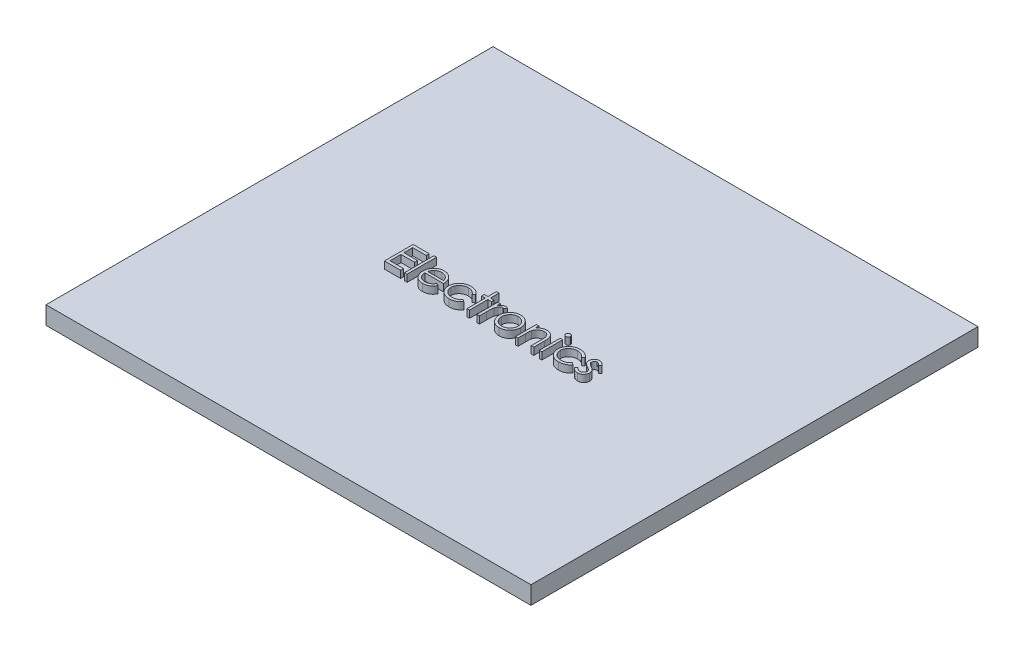
from build123d import *

# Parameters (mm, degrees)
SKETCH1_W           = 86.106
SKETCH1_H           = 79.375
BOSS_EXTRUDE1_DEPTH = 3.175
SKETCH2_W           = 0.455897436
SKETCH2_H           = 5.21025641
SKETCH2_H_2         = 3.712307692
BOSS_EXTRUDE2_DEPTH = 1.27


with BuildPart() as part:
    # Sketch1 → Boss-Extrude1 (new body)
    with BuildSketch(Plane(origin=(0, 0, 0), x_dir=(1, 0, 0), z_dir=(0, 1, 0))):
        with Locations((43.053, 39.6875)):
            Rectangle(SKETCH1_W, SKETCH1_H)
    extrude(amount=BOSS_EXTRUDE1_DEPTH)

    # Sketch2 → Boss-Extrude2 (add)
    # profile 1 of 12: a face of its own
    with BuildSketch(Plane(origin=(0, 3.175, 0), x_dir=(1, 0, 0), z_dir=(0, 1, 0))):
        Polygon((24.586053193, 40.592933787), (27.451694219, 40.592933787), (27.451694219, 40.071908146), (25.041950629, 40.071908146), (25.041950629, 38.508831223), (27.451694219, 38.508831223), (27.451694219, 37.987805582), (25.041950629, 37.987805582), (25.041950629, 36.033959428), (27.451694219, 36.033959428), (27.451694219, 35.512933787), (24.586053193, 35.512933787), align=None)
    # profile 2 of 12: a face of its own
    with BuildSketch(Plane(origin=(0, 3.175, 0), x_dir=(1, 0, 0), z_dir=(0, 1, 0))):
        with Locations((28.396053193, 38.118061992)):
            Rectangle(SKETCH2_W, SKETCH2_H)
    # profile 3 of 12: a face of its own
    with BuildSketch(Plane(origin=(0, 3.175, 0), x_dir=(1, 0, 0), z_dir=(0, 1, 0))):
        with BuildLine():
            Line((32.712832039, 36.685241479), (33.117848065, 36.472557184))
            add(Edge.make_bspline(
                [(33.117848065, 36.472557184), (33.085573235, 36.415308006), (33.022779198, 36.303923777), (32.914791827, 36.150896962), (32.801591904, 36.013232278), (32.678069574, 35.894607522), (32.54792044, 35.791191226), (32.410422758, 35.700712326), (32.264860702, 35.623614588), (32.111227387, 35.558659491), (31.94823261, 35.508716568), (31.775481381, 35.473440727), (31.592642753, 35.451635526), (31.467317441, 35.449102579), (31.403144539, 35.447805582)],
                knots=[0, 0, 0, 0, 1.120438281, 2.179929193, 3.190490725, 4.156257408, 5.095198341, 6.022838206, 6.959905092, 7.901321166, 8.864066838, 9.862729781, 10.905609505, 12, 12, 12, 12], degree=3))
            add(Edge.make_bspline(
                [(31.403144539, 35.447805582), (31.331818469, 35.449470625), (31.192681969, 35.452718641), (30.990149994, 35.480720275), (30.799462152, 35.526400156), (30.620629165, 35.590212999), (30.454088982, 35.673564658), (30.299510598, 35.775105849), (30.156081115, 35.89431495), (30.028320263, 36.032224531), (29.913303427, 36.179808629), (29.811811094, 36.333596027), (29.726964309, 36.493199792), (29.657945092, 36.657603867), (29.602203173, 36.825772033), (29.563353215, 36.999234392), (29.540958038, 37.177521468), (29.537526214, 37.298131315), (29.535796783, 37.358911351)],
                knots=[0, 0, 0, 0, 1.145258523, 2.234067595, 3.276747158, 4.290159414, 5.277019952, 6.260822364, 7.254936242, 8.264827045, 9.274100331, 10.257902744, 11.220704747, 12.172965371, 13.118907548, 14.062713208, 15.023725156, 16, 16, 16, 16], degree=3))
            add(Edge.make_bspline(
                [(29.535796783, 37.358911351), (29.537334051, 37.41594499), (29.540380713, 37.528978132), (29.559584256, 37.696277837), (29.593617778, 37.858879134), (29.640319414, 38.016917132), (29.70062808, 38.170127224), (29.774407416, 38.318602654), (29.861772353, 38.462185428), (29.929224119, 38.552759119), (29.963200629, 38.598382505)],
                knots=[0, 0, 0, 0, 1.024358464, 2.0301432, 3.019427413, 4.004406732, 4.986367066, 5.972626655, 6.978780325, 8, 8, 8, 8], degree=3))
            add(Edge.make_bspline(
                [(29.963200629, 38.598382505), (30.009222066, 38.653346465), (30.099807097, 38.761533266), (30.253014607, 38.90368375), (30.418913178, 39.02276443), (30.595423766, 39.12147193), (30.784597849, 39.196472538), (30.983892477, 39.252363543), (31.195576928, 39.283682484), (31.340291934, 39.288106197), (31.41433845, 39.290369684)],
                knots=[0, 0, 0, 0, 1.030682036, 2.02871468, 2.997146059, 3.962720338, 4.930598197, 5.918074684, 6.934738563, 8, 8, 8, 8], degree=3))
            add(Edge.make_bspline(
                [(31.41433845, 39.290369684), (31.490462403, 39.288404379), (31.639800245, 39.284548898), (31.857561152, 39.248805534), (32.063606992, 39.192123541), (32.257855313, 39.112071753), (32.440325808, 39.008788747), (32.609832417, 38.88085716), (32.769274041, 38.732204621), (32.862032778, 38.617885449), (32.909234283, 38.559712633)],
                knots=[0, 0, 0, 0, 1.056321875, 2.072262726, 3.055038591, 4.01806755, 4.982017516, 5.957941055, 6.960871419, 8, 8, 8, 8], degree=3))
            add(Edge.make_bspline(
                [(32.909234283, 38.559712633), (32.941349953, 38.515874292), (33.005367523, 38.428489411), (33.085554742, 38.286000989), (33.155161476, 38.136923897), (33.21079903, 37.978848381), (33.255850649, 37.81364739), (33.288445118, 37.640139925), (33.307559878, 37.458377654), (33.311317188, 37.334532253), (33.31323268, 37.271395325)],
                knots=[0, 0, 0, 0, 0.94817472, 1.890038105, 2.849395472, 3.817997239, 4.812318967, 5.836947057, 6.897266129, 8, 8, 8, 8], degree=3))
            Line((33.31323268, 37.271395325), (29.991694219, 37.271395325))
            add(Edge.make_bspline(
                [(29.991694219, 37.271395325), (29.993928848, 37.222481508), (29.998323155, 37.126294461), (30.018810277, 36.985548296), (30.051102783, 36.851474987), (30.096487594, 36.725080172), (30.151448615, 36.604713016), (30.21877417, 36.491266402), (30.299095579, 36.385257064), (30.388686023, 36.285736761), (30.488409464, 36.197111428), (30.593322709, 36.117788278), (30.704928226, 36.051304726), (30.822346016, 35.997340772), (30.945386207, 35.955095033), (31.074087564, 35.926258311), (31.20819683, 35.906943996), (31.299616124, 35.904796367), (31.34615736, 35.903703017)],
                knots=[0, 0, 0, 0, 1.094153842, 2.151609401, 3.174256925, 4.172055639, 5.149267565, 6.128595816, 7.11444997, 8.118368179, 9.117203808, 10.09244225, 11.054858984, 12.015122123, 12.976791628, 13.957293641, 14.960065497, 16, 16, 16, 16], degree=3))
            add(Edge.make_bspline(
                [(31.34615736, 35.903703017), (31.391661311, 35.904585568), (31.48194988, 35.906336718), (31.616411467, 35.923364749), (31.748693981, 35.950898749), (31.878249923, 35.98847622), (32.002449893, 36.034307766), (32.117469149, 36.089611342), (32.223249576, 36.150788689), (32.322116487, 36.220761588), (32.418013815, 36.306407757), (32.513144052, 36.413284746), (32.615145595, 36.539686072), (32.678993347, 36.634820925), (32.712832039, 36.685241479)],
                knots=[0, 0, 0, 0, 0.99110716, 1.966546729, 2.947904876, 3.932708344, 4.903319531, 5.828989031, 6.710028674, 7.56322171, 8.463672341, 9.504779593, 10.677557249, 12, 12, 12, 12], degree=3))
        make_face()
        with BuildLine():
            add(Edge.make_bspline(
                [(32.857335245, 37.727292761), (32.840648715, 37.787763446), (32.808532518, 37.90415005), (32.741423737, 38.065317971), (32.665845615, 38.20855641), (32.576406074, 38.332769135), (32.475069181, 38.443082805), (32.358018458, 38.539484637), (32.226757219, 38.625724823), (32.081963952, 38.698517594), (31.928632446, 38.760478874), (31.768095459, 38.802026185), (31.604290441, 38.830488035), (31.493496677, 38.833138501), (31.437743898, 38.834472248)],
                knots=[0, 0, 0, 0, 1.154881502, 2.222775134, 3.210006277, 4.132804581, 5.035138423, 5.962687519, 6.919655026, 7.923214229, 8.944639381, 9.960483929, 10.97369054, 12, 12, 12, 12], degree=3))
            add(Edge.make_bspline(
                [(31.437743898, 38.834472248), (31.392242428, 38.833584451), (31.302295586, 38.831829462), (31.169778607, 38.815181388), (31.042517787, 38.787662528), (30.919574112, 38.749976248), (30.802558681, 38.699744333), (30.68906456, 38.640840679), (30.581977585, 38.568934608), (30.51500679, 38.514130328), (30.481173386, 38.486443402)],
                knots=[0, 0, 0, 0, 1.04873581, 2.073130211, 3.073294108, 4.04793562, 5.032784715, 6.005352987, 6.992311501, 8, 8, 8, 8], degree=3))
            add(Edge.make_bspline(
                [(30.481173386, 38.486443402), (30.456944279, 38.464535081), (30.407910473, 38.420197979), (30.34239223, 38.343810445), (30.279660801, 38.261439606), (30.222570814, 38.169934111), (30.170206774, 38.070335952), (30.121206579, 37.963485213), (30.077102872, 37.848571069), (30.052289089, 37.768492215), (30.039522745, 37.727292761)],
                knots=[0, 0, 0, 0, 0.879870761, 1.780643979, 2.707998968, 3.669668524, 4.684282772, 5.740141944, 6.837334558, 8, 8, 8, 8], degree=3))
            Line((30.039522745, 37.727292761), (32.857335245, 37.727292761))
        make_face(mode=Mode.SUBTRACT)
    # profile 4 of 12: a face of its own
    with BuildSketch(Plane(origin=(0, 3.175, 0), x_dir=(1, 0, 0), z_dir=(0, 1, 0))):
        with BuildLine():
            Line((37.872207039, 38.420297569), (37.490596462, 38.183190197))
            add(Edge.make_bspline(
                [(37.490596462, 38.183190197), (37.448751972, 38.235192551), (37.366388197, 38.337550357), (37.223365534, 38.469644775), (37.070948967, 38.583098652), (36.906533972, 38.675560097), (36.730351154, 38.747001516), (36.543095313, 38.797555071), (36.344793151, 38.82905723), (36.208844805, 38.832637667), (36.139186206, 38.834472248)],
                knots=[0, 0, 0, 0, 1.026593902, 2.0206758, 2.988051866, 3.946915611, 4.916868779, 5.907761954, 6.927957743, 8, 8, 8, 8], degree=3))
            add(Edge.make_bspline(
                [(36.139186206, 38.834472248), (36.08351092, 38.832938317), (35.973859958, 38.829917282), (35.812887598, 38.81103348), (35.659555269, 38.776718794), (35.512901897, 38.731505405), (35.373970546, 38.670907841), (35.242397213, 38.59716111), (35.117014845, 38.511454194), (35.001456832, 38.412161174), (34.89575073, 38.304176822), (34.804167163, 38.18842003), (34.724430129, 38.068358016), (34.661864912, 37.940992631), (34.610665522, 37.809237673), (34.576982625, 37.670606134), (34.554536725, 37.526874055), (34.55196867, 37.428876007), (34.550668578, 37.379263915)],
                knots=[0, 0, 0, 0, 1.112346261, 2.190735716, 3.231507886, 4.247384806, 5.251966152, 6.253067467, 7.256802811, 8.280671706, 9.291813951, 10.270744147, 11.225547591, 12.165006084, 13.100104208, 14.043489273, 15.009504848, 16, 16, 16, 16], degree=3))
            add(Edge.make_bspline(
                [(34.550668578, 37.379263915), (34.553251035, 37.314284603), (34.558381154, 37.185201519), (34.598587844, 36.994660731), (34.664402012, 36.81044006), (34.75447455, 36.63384745), (34.868378505, 36.470425076), (35.002160397, 36.323854805), (35.155894381, 36.196976684), (35.328225878, 36.091787991), (35.515108545, 36.007225777), (35.714520469, 35.946980848), (35.92483215, 35.910619119), (36.068823657, 35.906038493), (36.142239091, 35.903703017)],
                knots=[0, 0, 0, 0, 0.966302908, 1.919585723, 2.883856336, 3.870342332, 4.860282998, 5.839159637, 6.814385684, 7.815993281, 8.834850808, 9.858348828, 10.908058873, 12, 12, 12, 12], degree=3))
            add(Edge.make_bspline(
                [(36.142239091, 35.903703017), (36.20952033, 35.905589145), (36.341745819, 35.909295886), (36.535028621, 35.940543638), (36.719040606, 35.991697255), (36.893775233, 36.063031558), (37.058913211, 36.15523721), (37.213387557, 36.268969949), (37.360272038, 36.400957929), (37.44662765, 36.503019442), (37.490596462, 36.554985069)],
                knots=[0, 0, 0, 0, 1.039848629, 2.043578496, 3.018386758, 3.987534228, 4.954977003, 5.934852016, 6.948509513, 8, 8, 8, 8], degree=3))
            Line((37.490596462, 36.554985069), (37.872207039, 36.30464853))
            add(Edge.make_bspline(
                [(37.872207039, 36.30464853), (37.849582603, 36.271424275), (37.804408824, 36.205086041), (37.728894442, 36.111550008), (37.647440514, 36.023997395), (37.56036482, 35.94254556), (37.468804337, 35.86524535), (37.369631256, 35.795792207), (37.266043363, 35.730282236), (37.156824586, 35.671335553), (37.043104144, 35.618349235), (36.925042056, 35.572787193), (36.803151357, 35.53364201), (36.677288731, 35.502527233), (36.547206044, 35.477692073), (36.413239717, 35.461212986), (36.27543589, 35.448911721), (36.182294597, 35.448177491), (36.135115693, 35.447805582)],
                knots=[0, 0, 0, 0, 0.954134338, 1.905101784, 2.851144739, 3.791306361, 4.734911809, 5.6936923, 6.663572882, 7.643865596, 8.638447847, 9.640600242, 10.646758161, 11.676244097, 12.717260333, 13.78922464, 14.880174919, 16, 16, 16, 16], degree=3))
            add(Edge.make_bspline(
                [(36.135115693, 35.447805582), (36.063109039, 35.44909921), (35.921975475, 35.451634733), (35.715404521, 35.479514463), (35.517990398, 35.521544374), (35.329800553, 35.581871165), (35.150805687, 35.659529525), (34.981172704, 35.754390418), (34.821463283, 35.867241587), (34.673256776, 35.996074407), (34.537139705, 36.135760823), (34.420261692, 36.286491561), (34.318886271, 36.442724853), (34.237479208, 36.607911251), (34.172677383, 36.779855277), (34.128401798, 36.959934369), (34.099765493, 37.146663926), (34.096451331, 37.274001938), (34.094771142, 37.338558787)],
                knots=[0, 0, 0, 0, 1.1129367, 2.181364009, 3.217532258, 4.231199276, 5.232079859, 6.230262199, 7.231623845, 8.250719726, 9.263571943, 10.242672461, 11.195837495, 12.138959767, 13.085126421, 14.0317438, 15.002148558, 16, 16, 16, 16], degree=3))
            add(Edge.make_bspline(
                [(34.094771142, 37.338558787), (34.095411245, 37.382360629), (34.096684517, 37.469489722), (34.111288686, 37.598804848), (34.130155041, 37.726397822), (34.162123825, 37.850651312), (34.199049085, 37.973449847), (34.246185, 38.09331332), (34.301477744, 38.210798731), (34.364254856, 38.325603436), (34.434923092, 38.435838767), (34.513127854, 38.539984086), (34.595923633, 38.639290489), (34.687183818, 38.730329547), (34.783035659, 38.816742076), (34.886190974, 38.896219582), (34.996058096, 38.968995649), (35.110987033, 39.03641598), (35.2309109, 39.096446246), (35.35510481, 39.148165345), (35.482820407, 39.192365084), (35.614261987, 39.227357458), (35.748557119, 39.256701604), (35.886764089, 39.27516065), (36.028354172, 39.288203583), (36.12422977, 39.289641647), (36.172767937, 39.290369684)],
                knots=[0, 0, 0, 0, 0.990994727, 1.971252077, 2.943264845, 3.907940874, 4.872158414, 5.844625996, 6.82015047, 7.809835459, 8.804511986, 9.781214284, 10.756496977, 11.728388426, 12.696359165, 13.676225489, 14.672885716, 15.677705647, 16.690706858, 17.706033469, 18.721040654, 19.747369689, 20.783475414, 21.830280724, 22.901553713, 24, 24, 24, 24], degree=3))
            add(Edge.make_bspline(
                [(36.172767937, 39.290369684), (36.233553922, 39.289031625), (36.354822056, 39.286362195), (36.534713139, 39.263896037), (36.71195462, 39.230024896), (36.883436702, 39.179844903), (37.047080214, 39.119082797), (37.200257382, 39.0508472), (37.339362447, 38.971607033), (37.466983062, 38.884927552), (37.583357905, 38.787158009), (37.689681568, 38.677129625), (37.788134362, 38.555415033), (37.843951532, 38.465708428), (37.872207039, 38.420297569)],
                knots=[0, 0, 0, 0, 1.095225653, 2.184976855, 3.262915854, 4.344593502, 5.400796181, 6.407717688, 7.363229445, 8.282371371, 9.184954523, 10.097238608, 11.036792983, 12, 12, 12, 12], degree=3))
        make_face()
    # profile 5 of 12: a face of its own
    with BuildSketch(Plane(origin=(0, 3.175, 0), x_dir=(1, 0, 0), z_dir=(0, 1, 0))):
        Polygon((39.239899347, 40.723190197), (39.695796783, 40.723190197), (39.695796783, 39.225241479), (40.347078834, 39.225241479), (40.347078834, 38.769344043), (39.695796783, 38.769344043), (39.695796783, 35.512933787), (39.239899347, 35.512933787), (39.239899347, 38.769344043), (38.588617296, 38.769344043), (38.588617296, 39.225241479), (39.239899347, 39.225241479), align=None)
    # profile 6 of 12: a face of its own
    with BuildSketch(Plane(origin=(0, 3.175, 0), x_dir=(1, 0, 0), z_dir=(0, 1, 0))):
        with BuildLine():
            Line((40.998360886, 39.225241479), (41.454258321, 39.225241479))
            Line((41.454258321, 39.225241479), (41.454258321, 38.678775133))
            add(Edge.make_bspline(
                [(41.454258321, 38.678775133), (41.487915148, 38.729656164), (41.552283569, 38.82696574), (41.65927262, 38.955662897), (41.768860313, 39.062219593), (41.88157127, 39.147133272), (41.998234341, 39.210724884), (42.116289116, 39.257305632), (42.237592941, 39.28484985), (42.319107963, 39.288527275), (42.359947424, 39.290369684)],
                knots=[0, 0, 0, 0, 1.2804753, 2.448899062, 3.506932113, 4.484331642, 5.4025378, 6.288909075, 7.142734305, 8, 8, 8, 8], degree=3))
            add(Edge.make_bspline(
                [(42.359947424, 39.290369684), (42.391626778, 39.28864172), (42.456809107, 39.285086321), (42.55548098, 39.260106038), (42.657144048, 39.220223651), (42.722664998, 39.182718414), (42.756822424, 39.163166158)],
                knots=[0, 0, 0, 0, 0.901110191, 1.854092781, 2.881294221, 4, 4, 4, 4], degree=3))
            Line((42.756822424, 39.163166158), (42.506485886, 38.768326415))
            add(Edge.make_bspline(
                [(42.506485886, 38.768326415), (42.484556221, 38.77810943), (42.442929518, 38.796679465), (42.382035462, 38.818657011), (42.325892265, 38.831597826), (42.2901239, 38.833558296), (42.273449027, 38.834472248)],
                knots=[0, 0, 0, 0, 1.180555205, 2.24091978, 3.179933427, 4, 4, 4, 4], degree=3))
            add(Edge.make_bspline(
                [(42.273449027, 38.834472248), (42.236864705, 38.832033794), (42.162243293, 38.827060054), (42.052682934, 38.787960299), (41.946369847, 38.724786522), (41.861937834, 38.654724451), (41.796562222, 38.587163648), (41.74991298, 38.528165395), (41.707120879, 38.462011267), (41.666233816, 38.389832183), (41.628981023, 38.310395721), (41.594212532, 38.224495514), (41.562776239, 38.13203207), (41.544850742, 38.067614012), (41.535668578, 38.034616479)],
                knots=[0, 0, 0, 0, 1.125678352, 2.296057538, 3.5422874, 4.923748041, 5.663163013, 6.437101912, 7.23742474, 8.08941207, 8.991984279, 9.93940061, 10.944477711, 12, 12, 12, 12], degree=3))
            add(Edge.make_bspline(
                [(41.535668578, 38.034616479), (41.528799847, 38.00518561), (41.51358613, 37.939998471), (41.498793841, 37.83063547), (41.484178655, 37.701423988), (41.47387842, 37.552004362), (41.464330862, 37.382749729), (41.458945942, 37.193402242), (41.454441955, 36.983767549), (41.45432139, 36.837210488), (41.454258321, 36.760545966)],
                knots=[0, 0, 0, 0, 0.566838948, 1.255505196, 2.06880316, 3.007127437, 4.065329342, 5.249902469, 6.561414163, 8, 8, 8, 8], degree=3))
            Line((41.454258321, 36.760545966), (41.454258321, 35.512933787))
            Line((41.454258321, 35.512933787), (40.998360886, 35.512933787))
            Line((40.998360886, 35.512933787), (40.998360886, 39.225241479))
        make_face()
    # profile 7 of 12: a face of its own
    with BuildSketch(Plane(origin=(0, 3.175, 0), x_dir=(1, 0, 0), z_dir=(0, 1, 0))):
        with BuildLine():
            add(Edge.make_bspline(
                [(45.005780757, 39.290369684), (45.075436662, 39.288886482), (45.212014868, 39.285978285), (45.412033171, 39.254895992), (45.602961539, 39.207365532), (45.785531213, 39.141657093), (45.957404007, 39.053581577), (46.121083413, 38.948484663), (46.276120672, 38.823977355), (46.369045525, 38.727663359), (46.41621345, 38.678775133)],
                knots=[0, 0, 0, 0, 1.054011418, 2.066658804, 3.057071809, 4.030435133, 4.997543892, 5.974964718, 6.972108034, 8, 8, 8, 8], degree=3))
            add(Edge.make_bspline(
                [(46.41621345, 38.678775133), (46.456827257, 38.632018833), (46.537268883, 38.539411098), (46.640415698, 38.389252665), (46.72927442, 38.233746462), (46.800485803, 38.070827485), (46.856634352, 37.901917963), (46.896498848, 37.726437329), (46.920210742, 37.544773122), (46.923408191, 37.421396123), (46.925027552, 37.358911351)],
                knots=[0, 0, 0, 0, 1.025258237, 2.030674902, 3.01204498, 3.988269485, 4.97094183, 5.956517959, 6.965070386, 8, 8, 8, 8], degree=3))
            add(Edge.make_bspline(
                [(46.925027552, 37.358911351), (46.923603211, 37.29606441), (46.920788647, 37.171875924), (46.894164198, 36.988967816), (46.852753365, 36.811610759), (46.793488868, 36.640547283), (46.717494812, 36.475254494), (46.624762043, 36.316454348), (46.51463981, 36.163833537), (46.389811152, 36.018688012), (46.251850143, 35.884915335), (46.102184419, 35.768324589), (45.943755136, 35.668435062), (45.774455641, 35.587973065), (45.595831974, 35.524531557), (45.407498858, 35.479972676), (45.20974887, 35.453031718), (45.074726503, 35.449572132), (45.005780757, 35.447805582)],
                knots=[0, 0, 0, 0, 0.998656419, 1.973391657, 2.932242238, 3.890759089, 4.846373663, 5.82037756, 6.809684879, 7.83454468, 8.860553229, 9.859544525, 10.845671541, 11.83227036, 12.833544569, 13.85385346, 14.904124723, 16, 16, 16, 16], degree=3))
            add(Edge.make_bspline(
                [(45.005780757, 35.447805582), (44.936497222, 35.449578061), (44.800801917, 35.45304955), (44.60235392, 35.479868007), (44.413683273, 35.524511021), (44.234825764, 35.588181554), (44.064798387, 35.668437634), (43.905451128, 35.768022601), (43.755663822, 35.884949912), (43.617673628, 36.018678643), (43.492852795, 36.163835951), (43.382728543, 36.316453721), (43.289996298, 36.475254657), (43.214002105, 36.64054724), (43.154737645, 36.811610771), (43.113326802, 36.988967813), (43.086702356, 37.171875925), (43.083887791, 37.29606441), (43.08246345, 37.358911351)],
                knots=[0, 0, 0, 0, 1.099876186, 2.154163076, 3.173186993, 4.173200201, 5.163417411, 6.152872554, 7.150605724, 8.17532212, 9.198891216, 10.186952605, 11.159729845, 12.11414092, 13.071450619, 14.029093627, 15.002601286, 16, 16, 16, 16], degree=3))
            add(Edge.make_bspline(
                [(43.08246345, 37.358911351), (43.084093854, 37.421056509), (43.087321776, 37.544093241), (43.111009829, 37.725415947), (43.150718819, 37.900599586), (43.206934675, 38.068857134), (43.278802438, 38.231062166), (43.366412535, 38.386952607), (43.470611511, 38.536432043), (43.5507332, 38.628920091), (43.591277552, 38.675722248)],
                knots=[0, 0, 0, 0, 1.031353054, 2.041901799, 3.029428768, 4.008703097, 4.981709435, 5.96992636, 6.972712378, 8, 8, 8, 8], degree=3))
            add(Edge.make_bspline(
                [(43.591277552, 38.675722248), (43.638374364, 38.725034446), (43.730998532, 38.822015559), (43.886807543, 38.946159908), (44.050084289, 39.05344381), (44.223856468, 39.139769288), (44.406276159, 39.207752051), (44.598182945, 39.25501857), (44.798879979, 39.285866297), (44.936126514, 39.288853595), (45.005780757, 39.290369684)],
                knots=[0, 0, 0, 0, 1.027980169, 2.021703884, 2.998553061, 3.971491411, 4.943284454, 5.930300938, 6.949603206, 8, 8, 8, 8], degree=3))
        make_face()
        with BuildLine():
            add(Edge.make_bspline(
                [(45.003745501, 38.834472248), (44.954487482, 38.833072212), (44.857243033, 38.830308282), (44.71410375, 38.809285929), (44.576304898, 38.775979266), (44.443585044, 38.728656807), (44.316391754, 38.667553262), (44.19460325, 38.592502271), (44.077861308, 38.504497866), (43.968449628, 38.403677759), (43.868036443, 38.293544819), (43.78025698, 38.176199201), (43.705617111, 38.053544275), (43.643437681, 37.925452495), (43.597126676, 37.790625791), (43.563492689, 37.650591046), (43.542490169, 37.505062956), (43.539752225, 37.406132107), (43.538360886, 37.355858466)],
                knots=[0, 0, 0, 0, 1.021534396, 2.016698045, 2.994645724, 3.958388632, 4.93408049, 5.916473867, 6.921342795, 7.962252576, 8.998418191, 10.008913653, 10.997312074, 11.973003931, 12.956656626, 13.948281152, 14.957379055, 16, 16, 16, 16], degree=3))
            add(Edge.make_bspline(
                [(43.538360886, 37.355858466), (43.540693075, 37.290904095), (43.545322036, 37.161981815), (43.582965179, 36.972118814), (43.645937265, 36.789845726), (43.730972517, 36.616231086), (43.8375164, 36.455598179), (43.9630462, 36.312383568), (44.106214679, 36.188742447), (44.265315199, 36.086154249), (44.437098038, 36.004642375), (44.618898641, 35.946877004), (44.808514277, 35.909326091), (44.938098881, 35.905593779), (45.003745501, 35.903703017)],
                knots=[0, 0, 0, 0, 1.016792936, 2.018143844, 3.017858371, 4.030088057, 5.03801393, 6.028138512, 7.003788237, 7.991172063, 8.984598303, 9.972568034, 10.972917682, 12, 12, 12, 12], degree=3))
            add(Edge.make_bspline(
                [(45.003745501, 35.903703017), (45.069388345, 35.905604796), (45.198965496, 35.909358853), (45.388317672, 35.946687883), (45.56962138, 36.004895482), (45.741225794, 36.086062575), (45.900253893, 36.189132023), (46.044452046, 36.311685393), (46.16891003, 36.455977497), (46.27534852, 36.616443853), (46.361776363, 36.78957657), (46.424453696, 36.972152455), (46.462187335, 37.161973248), (46.466804081, 37.290901225), (46.469130116, 37.355858466)],
                knots=[0, 0, 0, 0, 1.02726834, 2.027799167, 3.010890988, 4.004497153, 4.992059811, 5.971914811, 6.958719428, 7.966827853, 8.981595046, 9.981490638, 10.983022906, 12, 12, 12, 12], degree=3))
            add(Edge.make_bspline(
                [(46.469130116, 37.355858466), (46.467739256, 37.406132407), (46.465002255, 37.505063848), (46.443992878, 37.650587638), (46.410384266, 37.790638298), (46.363979747, 37.925406348), (46.302070493, 38.053875926), (46.225991262, 38.175839073), (46.138570231, 38.293951317), (46.036945381, 38.403321744), (45.927647907, 38.504537168), (45.810858651, 38.592536396), (45.689250739, 38.667223421), (45.562426968, 38.72917945), (45.429690098, 38.775548732), (45.292084322, 38.809478243), (45.149555764, 38.830219443), (45.052659781, 38.83304558), (45.003745501, 38.834472248)],
                knots=[0, 0, 0, 0, 1.042956736, 2.052379634, 3.044323526, 4.02829302, 5.004299113, 5.996692471, 7.007513377, 8.048758398, 9.090003419, 10.095195979, 11.07790575, 12.047570684, 13.018257071, 13.989683339, 14.985167495, 16, 16, 16, 16], degree=3))
        make_face(mode=Mode.SUBTRACT)
    # profile 8 of 12: a face of its own
    with BuildSketch(Plane(origin=(0, 3.175, 0), x_dir=(1, 0, 0), z_dir=(0, 1, 0))):
        with BuildLine():
            Line((47.836822424, 39.225241479), (48.29271986, 39.225241479))
            Line((48.29271986, 39.225241479), (48.29271986, 38.55564212))
            add(Edge.make_bspline(
                [(48.29271986, 38.55564212), (48.341397342, 38.616373843), (48.435857694, 38.734225872), (48.593169812, 38.889123163), (48.759422101, 39.016769375), (48.933596438, 39.118520024), (49.115929264, 39.195223128), (49.305309153, 39.25061825), (49.502869926, 39.283833944), (49.637220595, 39.28817405), (49.705187809, 39.290369684)],
                knots=[0, 0, 0, 0, 1.12780773, 2.188550248, 3.19190651, 4.159438251, 5.104880172, 6.052711206, 7.014878035, 8, 8, 8, 8], degree=3))
            add(Edge.make_bspline(
                [(49.705187809, 39.290369684), (49.773884843, 39.287836658), (49.908341511, 39.282878914), (50.104107383, 39.243666116), (50.286948766, 39.176689575), (50.456213721, 39.084941769), (50.608798362, 38.970850088), (50.742801289, 38.837931479), (50.853637088, 38.685043678), (50.927946404, 38.543205497), (50.976896772, 38.417382904), (51.007713994, 38.30961905), (51.033884675, 38.189559562), (51.056573041, 38.057567244), (51.071924963, 37.9127173), (51.084033204, 37.755603506), (51.092710851, 37.586276757), (51.09305514, 37.469165881), (51.09323268, 37.408775133)],
                knots=[0, 0, 0, 0, 1.235846778, 2.418850247, 3.575807741, 4.728682307, 5.871620074, 6.994088408, 8.11269785, 9.256955736, 9.865816715, 10.540099792, 11.271859618, 12.076849838, 12.949306005, 13.892391288, 14.913166135, 16, 16, 16, 16], degree=3))
            Line((51.09323268, 37.408775133), (51.09323268, 35.512933787))
            Line((51.09323268, 35.512933787), (50.637335245, 35.512933787))
            Line((50.637335245, 35.512933787), (50.637335245, 37.259183787))
            add(Edge.make_bspline(
                [(50.637335245, 37.259183787), (50.637054817, 37.309726078), (50.636518407, 37.40640488), (50.634826554, 37.544826205), (50.63074832, 37.670355296), (50.625017626, 37.782692047), (50.616629776, 37.881728586), (50.607888357, 37.967666622), (50.597198619, 38.040397044), (50.587673019, 38.084179506), (50.58340095, 38.103815197)],
                knots=[0, 0, 0, 0, 1.430800155, 2.736877192, 3.918605307, 4.986035426, 5.920637409, 6.731861385, 7.431261377, 8, 8, 8, 8], degree=3))
            add(Edge.make_bspline(
                [(50.58340095, 38.103815197), (50.56797875, 38.161453145), (50.538295786, 38.272388363), (50.464949319, 38.422864281), (50.372327594, 38.550877651), (50.25926443, 38.655637006), (50.126851943, 38.737164964), (49.975457576, 38.793732875), (49.806542291, 38.829113289), (49.687736502, 38.832636098), (49.625812809, 38.834472248)],
                knots=[0, 0, 0, 0, 1.084156227, 2.086665306, 3.027808233, 3.945421172, 4.874247719, 5.839848303, 6.874090471, 8, 8, 8, 8], degree=3))
            add(Edge.make_bspline(
                [(49.625812809, 38.834472248), (49.589138571, 38.833781361), (49.516561201, 38.832414114), (49.408937814, 38.81869623), (49.304545014, 38.796259386), (49.20233511, 38.76597005), (49.10435237, 38.724368813), (49.00744877, 38.677154756), (48.915273238, 38.618301922), (48.825860307, 38.552710963), (48.742674861, 38.480024571), (48.665272587, 38.403324539), (48.596274546, 38.32164452), (48.53376344, 38.236300596), (48.479801846, 38.146120671), (48.432698507, 38.051974764), (48.392732413, 37.953738959), (48.372872962, 37.885558013), (48.362936206, 37.851443402)],
                knots=[0, 0, 0, 0, 1.023777757, 2.026029729, 3.023749952, 4.003683103, 4.997618607, 5.993177895, 7.010360494, 8.046726602, 9.087585522, 10.09234134, 11.086953743, 12.070360549, 13.043493632, 14.017870808, 15.008233677, 16, 16, 16, 16], degree=3))
            add(Edge.make_bspline(
                [(48.362936206, 37.851443402), (48.357218088, 37.826398707), (48.344770043, 37.771877717), (48.331325199, 37.682405245), (48.319122204, 37.57890391), (48.308908561, 37.46149449), (48.302659556, 37.329765917), (48.295845975, 37.184280758), (48.293365395, 37.024458895), (48.292941064, 36.913189924), (48.29271986, 36.855185389)],
                knots=[0, 0, 0, 0, 0.615963638, 1.340920617, 2.168419149, 3.115676021, 4.16674242, 5.331190069, 6.6087489, 8, 8, 8, 8], degree=3))
            Line((48.29271986, 36.855185389), (48.29271986, 35.512933787))
            Line((48.29271986, 35.512933787), (47.836822424, 35.512933787))
            Line((47.836822424, 35.512933787), (47.836822424, 39.225241479))
        make_face()
    # profile 9 of 12: a face of its own
    with BuildSketch(Plane(origin=(0, 3.175, 0), x_dir=(1, 0, 0), z_dir=(0, 1, 0))):
        with BuildLine():
            add(Edge.make_bspline(
                [(52.296069219, 40.788318402), (52.324359472, 40.787006089), (52.37975722, 40.784436329), (52.459866305, 40.762430528), (52.532810769, 40.725129271), (52.597512164, 40.675084477), (52.653032045, 40.616229856), (52.691902333, 40.547633936), (52.716884897, 40.473525969), (52.719901771, 40.421833211), (52.721437809, 40.395513915)],
                knots=[0, 0, 0, 0, 1.055194115, 2.066272739, 3.074728998, 4.095836921, 5.109056067, 6.073838105, 7.019297344, 8, 8, 8, 8], degree=3))
            add(Edge.make_bspline(
                [(52.721437809, 40.395513915), (52.719867131, 40.369877835), (52.716762087, 40.31919834), (52.69192163, 40.246375129), (52.652700782, 40.178732341), (52.597547765, 40.119991996), (52.532801335, 40.069974867), (52.459868811, 40.032666275), (52.37975656, 40.010662418), (52.324359249, 40.00809239), (52.296069219, 40.00677994)],
                knots=[0, 0, 0, 0, 0.96129708, 1.900370562, 2.859976407, 3.87933698, 4.906634145, 5.921202961, 6.938410037, 8, 8, 8, 8], degree=3))
            add(Edge.make_bspline(
                [(52.296069219, 40.00677994), (52.268102694, 40.008042277), (52.213669507, 40.010499251), (52.134759918, 40.033098019), (52.062437425, 40.069987634), (51.997609843, 40.119664497), (51.943572877, 40.179093091), (51.904241593, 40.246333849), (51.879458506, 40.31920885), (51.876345731, 40.369881366), (51.874771142, 40.395513915)],
                knots=[0, 0, 0, 0, 1.054934014, 2.053291228, 3.073705704, 4.106921865, 5.123545215, 6.088680038, 7.033164197, 8, 8, 8, 8], degree=3))
            add(Edge.make_bspline(
                [(51.874771142, 40.395513915), (51.876311233, 40.421829548), (51.87933607, 40.473515112), (51.90426017, 40.547675903), (51.943245263, 40.615866197), (51.997645623, 40.675411779), (52.062427903, 40.725116581), (52.134762379, 40.761998806), (52.213668857, 40.784599493), (52.268102473, 40.787056201), (52.296069219, 40.788318402)],
                knots=[0, 0, 0, 0, 0.98631895, 1.937192651, 2.907499808, 3.917963147, 4.944918757, 5.95915025, 6.951458133, 8, 8, 8, 8], degree=3))
        make_face()
    # profile 10 of 12: a face of its own
    with BuildSketch(Plane(origin=(0, 3.175, 0), x_dir=(1, 0, 0), z_dir=(0, 1, 0))):
        with Locations((52.298104475, 37.369087633)):
            Rectangle(SKETCH2_W, SKETCH2_H_2)
    # profile 11 of 12: a face of its own
    with BuildSketch(Plane(origin=(0, 3.175, 0), x_dir=(1, 0, 0), z_dir=(0, 1, 0))):
        with BuildLine():
            Line((57.280412168, 38.420297569), (56.898801591, 38.183190197))
            add(Edge.make_bspline(
                [(56.898801591, 38.183190197), (56.8569571, 38.235192551), (56.774593326, 38.337550357), (56.631570663, 38.469644775), (56.479154096, 38.583098652), (56.314739101, 38.675560097), (56.138556282, 38.747001516), (55.951300441, 38.797555071), (55.75299828, 38.82905723), (55.617049934, 38.832637667), (55.547391334, 38.834472248)],
                knots=[0, 0, 0, 0, 1.026593902, 2.0206758, 2.988051866, 3.946915611, 4.916868779, 5.907761954, 6.927957743, 8, 8, 8, 8], degree=3))
            add(Edge.make_bspline(
                [(55.547391334, 38.834472248), (55.491716048, 38.832938317), (55.382065086, 38.829917282), (55.221092726, 38.81103348), (55.067760397, 38.776718794), (54.921107025, 38.731505405), (54.782175675, 38.670907841), (54.650602342, 38.59716111), (54.525219973, 38.511454194), (54.40966196, 38.412161174), (54.303955858, 38.304176822), (54.212372292, 38.18842003), (54.132635257, 38.068358016), (54.070070041, 37.940992631), (54.01887065, 37.809237673), (53.985187754, 37.670606134), (53.962741853, 37.526874055), (53.960173799, 37.428876007), (53.958873706, 37.379263915)],
                knots=[0, 0, 0, 0, 1.112346261, 2.190735716, 3.231507886, 4.247384806, 5.251966152, 6.253067467, 7.256802811, 8.280671706, 9.291813951, 10.270744147, 11.225547591, 12.165006084, 13.100104208, 14.043489273, 15.009504848, 16, 16, 16, 16], degree=3))
            add(Edge.make_bspline(
                [(53.958873706, 37.379263915), (53.961456164, 37.314284603), (53.966586282, 37.185201519), (54.006792972, 36.994660731), (54.072607141, 36.81044006), (54.162679678, 36.63384745), (54.276583633, 36.470425076), (54.410365525, 36.323854805), (54.564099509, 36.196976684), (54.736431006, 36.091787991), (54.923313674, 36.007225777), (55.122725597, 35.946980848), (55.333037278, 35.910619119), (55.477028786, 35.906038493), (55.550444219, 35.903703017)],
                knots=[0, 0, 0, 0, 0.966302908, 1.919585723, 2.883856336, 3.870342332, 4.860282998, 5.839159637, 6.814385684, 7.815993281, 8.834850808, 9.858348828, 10.908058873, 12, 12, 12, 12], degree=3))
            add(Edge.make_bspline(
                [(55.550444219, 35.903703017), (55.617725458, 35.905589145), (55.749950947, 35.909295886), (55.943233749, 35.940543638), (56.127245734, 35.991697255), (56.301980361, 36.063031558), (56.467118339, 36.15523721), (56.621592685, 36.268969949), (56.768477167, 36.400957929), (56.854832778, 36.503019442), (56.898801591, 36.554985069)],
                knots=[0, 0, 0, 0, 1.039848629, 2.043578496, 3.018386758, 3.987534228, 4.954977003, 5.934852016, 6.948509513, 8, 8, 8, 8], degree=3))
            Line((56.898801591, 36.554985069), (57.280412168, 36.30464853))
            add(Edge.make_bspline(
                [(57.280412168, 36.30464853), (57.257787731, 36.271424275), (57.212613952, 36.205086041), (57.13709957, 36.111550008), (57.055645643, 36.023997395), (56.968569948, 35.94254556), (56.877009465, 35.86524535), (56.777836385, 35.795792207), (56.674248491, 35.730282236), (56.565029714, 35.671335553), (56.451309272, 35.618349235), (56.333247185, 35.572787193), (56.211356485, 35.53364201), (56.085493859, 35.502527233), (55.955411172, 35.477692073), (55.821444846, 35.461212986), (55.683641019, 35.448911721), (55.590499725, 35.448177491), (55.543320821, 35.447805582)],
                knots=[0, 0, 0, 0, 0.954134338, 1.905101784, 2.851144739, 3.791306361, 4.734911809, 5.6936923, 6.663572882, 7.643865596, 8.638447847, 9.640600242, 10.646758161, 11.676244097, 12.717260333, 13.78922464, 14.880174919, 16, 16, 16, 16], degree=3))
            add(Edge.make_bspline(
                [(55.543320821, 35.447805582), (55.471314167, 35.44909921), (55.330180603, 35.451634733), (55.123609649, 35.479514463), (54.926195526, 35.521544374), (54.738005681, 35.581871165), (54.559010815, 35.659529525), (54.389377832, 35.754390418), (54.229668412, 35.867241587), (54.081461904, 35.996074407), (53.945344834, 36.135760823), (53.82846682, 36.286491561), (53.727091399, 36.442724853), (53.645684336, 36.607911251), (53.580882512, 36.779855277), (53.536606926, 36.959934369), (53.507970621, 37.146663926), (53.504656459, 37.274001938), (53.50297627, 37.338558787)],
                knots=[0, 0, 0, 0, 1.1129367, 2.181364009, 3.217532258, 4.231199276, 5.232079859, 6.230262199, 7.231623845, 8.250719726, 9.263571943, 10.242672461, 11.195837495, 12.138959767, 13.085126421, 14.0317438, 15.002148558, 16, 16, 16, 16], degree=3))
            add(Edge.make_bspline(
                [(53.50297627, 37.338558787), (53.503616374, 37.382360629), (53.504889645, 37.469489722), (53.519493814, 37.598804848), (53.538360169, 37.726397822), (53.570328953, 37.850651312), (53.607254213, 37.973449847), (53.654390128, 38.09331332), (53.709682872, 38.210798731), (53.772459985, 38.325603436), (53.84312822, 38.435838767), (53.921332982, 38.539984086), (54.004128761, 38.639290489), (54.095388947, 38.730329547), (54.191240787, 38.816742076), (54.294396103, 38.896219582), (54.404263224, 38.968995649), (54.519192161, 39.03641598), (54.639116028, 39.096446246), (54.763309938, 39.148165345), (54.891025535, 39.192365084), (55.022467116, 39.227357458), (55.156762247, 39.256701604), (55.294969217, 39.27516065), (55.4365593, 39.288203583), (55.532434899, 39.289641647), (55.580973065, 39.290369684)],
                knots=[0, 0, 0, 0, 0.990994727, 1.971252077, 2.943264845, 3.907940874, 4.872158414, 5.844625996, 6.82015047, 7.809835459, 8.804511986, 9.781214284, 10.756496977, 11.728388426, 12.696359165, 13.676225489, 14.672885716, 15.677705647, 16.690706858, 17.706033469, 18.721040654, 19.747369689, 20.783475414, 21.830280724, 22.901553713, 24, 24, 24, 24], degree=3))
            add(Edge.make_bspline(
                [(55.580973065, 39.290369684), (55.64175905, 39.289031625), (55.763027184, 39.286362195), (55.942918267, 39.263896037), (56.120159749, 39.230024896), (56.29164183, 39.179844903), (56.455285343, 39.119082797), (56.60846251, 39.0508472), (56.747567575, 38.971607033), (56.87518819, 38.884927552), (56.991563033, 38.787158009), (57.097886696, 38.677129625), (57.19633949, 38.555415033), (57.25215666, 38.465708428), (57.280412168, 38.420297569)],
                knots=[0, 0, 0, 0, 1.095225653, 2.184976855, 3.262915854, 4.344593502, 5.400796181, 6.407717688, 7.363229445, 8.282371371, 9.184954523, 10.097238608, 11.036792983, 12, 12, 12, 12], degree=3))
        make_face()
    # profile 12 of 12: a face of its own
    with BuildSketch(Plane(origin=(0, 3.175, 0), x_dir=(1, 0, 0), z_dir=(0, 1, 0))):
        with BuildLine():
            Line((59.950668578, 38.762220646), (59.641309604, 38.443703017))
            add(Edge.make_bspline(
                [(59.641309604, 38.443703017), (59.614617101, 38.474637527), (59.563157099, 38.53427562), (59.481541121, 38.614012848), (59.400226862, 38.680977319), (59.320327441, 38.73751374), (59.239833725, 38.780257073), (59.159690313, 38.81145533), (59.079814223, 38.830761951), (59.026421921, 38.833250336), (59.000203834, 38.834472248)],
                knots=[0, 0, 0, 0, 1.26578478, 2.440284043, 3.530471711, 4.527705817, 5.468200915, 6.346673037, 7.188140097, 8, 8, 8, 8], degree=3))
            add(Edge.make_bspline(
                [(59.000203834, 38.834472248), (58.968070091, 38.832912147), (58.904835433, 38.829842088), (58.814228817, 38.799197452), (58.730117624, 38.752158483), (58.65731835, 38.685438368), (58.595650517, 38.6088548), (58.550636374, 38.523225849), (58.523108604, 38.431135545), (58.519618307, 38.367229352), (58.517848065, 38.334816799)],
                knots=[0, 0, 0, 0, 0.99966794, 1.967205029, 2.953328237, 3.988086729, 5.028030931, 6.008226631, 6.989793394, 8, 8, 8, 8], degree=3))
            add(Edge.make_bspline(
                [(58.517848065, 38.334816799), (58.51946033, 38.305480461), (58.522680314, 38.246890483), (58.547712637, 38.160460765), (58.587577679, 38.076195121), (58.624836132, 38.024578103), (58.644033962, 37.997981864)],
                knots=[0, 0, 0, 0, 0.960159726, 1.917612774, 2.927026955, 4, 4, 4, 4], degree=3))
            add(Edge.make_bspline(
                [(58.644033962, 37.997981864), (58.655592405, 37.983780238), (58.680193093, 37.953553869), (58.72636088, 37.91160199), (58.77864497, 37.865240094), (58.841520765, 37.818886057), (58.9122794, 37.77007201), (58.992455276, 37.720720343), (59.079503986, 37.66706912), (59.141824419, 37.633041197), (59.174218257, 37.615353658)],
                knots=[0, 0, 0, 0, 0.66740084, 1.420478572, 2.27185888, 3.217733974, 4.268547843, 5.408967954, 6.65319498, 8, 8, 8, 8], degree=3))
            add(Edge.make_bspline(
                [(59.174218257, 37.615353658), (59.213716821, 37.593226771), (59.290015039, 37.55048491), (59.398426255, 37.484140541), (59.496814303, 37.418200073), (59.586012815, 37.353368716), (59.664305498, 37.287832554), (59.734067763, 37.224103581), (59.793559562, 37.160256242), (59.826875547, 37.115649323), (59.842799988, 37.094328017)],
                knots=[0, 0, 0, 0, 1.27191281, 2.456916733, 3.569705269, 4.599008579, 5.553216877, 6.436649441, 7.252746552, 8, 8, 8, 8], degree=3))
            add(Edge.make_bspline(
                [(59.842799988, 37.094328017), (59.869231268, 37.05126981), (59.92183442, 36.965575985), (59.977073276, 36.824470381), (60.009092189, 36.674812852), (60.013536783, 36.572440373), (60.015796783, 36.52038571)],
                knots=[0, 0, 0, 0, 0.995354457, 1.980940102, 2.973342415, 4, 4, 4, 4], degree=3))
            add(Edge.make_bspline(
                [(60.015796783, 36.52038571), (60.014752431, 36.483709349), (60.012694421, 36.411434573), (59.998386141, 36.304994306), (59.973777204, 36.203199006), (59.94025827, 36.104944135), (59.89499638, 36.012112303), (59.841949863, 35.922361404), (59.778268563, 35.83763291), (59.705564509, 35.758038077), (59.625960192, 35.685342192), (59.541042711, 35.621444568), (59.450707494, 35.56835953), (59.355600022, 35.524431543), (59.255504205, 35.489498185), (59.15040439, 35.465313712), (59.040634655, 35.450838961), (58.965987962, 35.448829493), (58.927952232, 35.447805582)],
                knots=[0, 0, 0, 0, 1.032770009, 2.035186124, 3.017557409, 3.978232242, 4.952395191, 5.920591857, 6.910227898, 7.931268572, 8.952309245, 9.941945286, 10.918353717, 11.897095711, 12.887975737, 13.898235213, 14.929059601, 16, 16, 16, 16], degree=3))
            add(Edge.make_bspline(
                [(58.927952232, 35.447805582), (58.876619303, 35.449246415), (58.774666712, 35.452108062), (58.623878205, 35.478968288), (58.476528075, 35.520762746), (58.333731394, 35.578407587), (58.198681606, 35.651197765), (58.07512015, 35.738374039), (57.962617798, 35.837056664), (57.898583275, 35.912694831), (57.866566014, 35.950513915)],
                knots=[0, 0, 0, 0, 1.013940152, 2.01379169, 3.017749504, 4.037548394, 5.051665909, 6.043208538, 7.021604269, 8, 8, 8, 8], degree=3))
            Line((57.866566014, 35.950513915), (58.168801591, 36.294472248))
            add(Edge.make_bspline(
                [(58.168801591, 36.294472248), (58.197499836, 36.263477333), (58.253135723, 36.203389003), (58.342110061, 36.12337996), (58.432649306, 36.056322115), (58.523849365, 36.000233959), (58.617060245, 35.957017088), (58.711759594, 35.926655243), (58.807754792, 35.907141958), (58.872230349, 35.904851194), (58.904546783, 35.903703017)],
                knots=[0, 0, 0, 0, 1.179806542, 2.287233372, 3.337373186, 4.324005949, 5.273901747, 6.200048787, 7.097828587, 8, 8, 8, 8], degree=3))
            add(Edge.make_bspline(
                [(58.904546783, 35.903703017), (58.948551087, 35.905692672), (59.034528115, 35.909580123), (59.157672771, 35.944874645), (59.271375691, 36.000217546), (59.370106719, 36.078717623), (59.454147569, 36.170093139), (59.51500332, 36.273019918), (59.553141312, 36.384477232), (59.557620418, 36.461740117), (59.559899347, 36.501050774)],
                knots=[0, 0, 0, 0, 1.072336372, 2.095165389, 3.102688358, 4.141489647, 5.156069229, 6.117746104, 7.042326257, 8, 8, 8, 8], degree=3))
            add(Edge.make_bspline(
                [(59.559899347, 36.501050774), (59.558322668, 36.533431592), (59.555209728, 36.597363182), (59.530762921, 36.689892249), (59.492136267, 36.77765909), (59.454102092, 36.829024636), (59.434731078, 36.855185389)],
                knots=[0, 0, 0, 0, 1.013901739, 2.00181326, 2.98231254, 4, 4, 4, 4], degree=3))
            add(Edge.make_bspline(
                [(59.434731078, 36.855185389), (59.423087145, 36.868299572), (59.397722455, 36.896866998), (59.351196562, 36.93812397), (59.295488031, 36.982592983), (59.229970308, 37.029519974), (59.154511318, 37.07828595), (59.068805222, 37.128635067), (58.974026135, 37.182958738), (58.907012761, 37.218982695), (58.87198268, 37.237813594)],
                knots=[0, 0, 0, 0, 0.615000592, 1.339693406, 2.178160186, 3.116406724, 4.166410947, 5.330106347, 6.604359322, 8, 8, 8, 8], degree=3))
            add(Edge.make_bspline(
                [(58.87198268, 37.237813594), (58.834177843, 37.258916105), (58.760862198, 37.299840609), (58.657016416, 37.363581663), (58.563330542, 37.428413021), (58.477550279, 37.490697942), (58.401842305, 37.553720341), (58.336504872, 37.61755018), (58.278965575, 37.679613246), (58.247110475, 37.723587608), (58.231894539, 37.74459244)],
                knots=[0, 0, 0, 0, 1.262093308, 2.447601706, 3.550203992, 4.582594899, 5.537233252, 6.418365656, 7.244515135, 8, 8, 8, 8], degree=3))
            add(Edge.make_bspline(
                [(58.231894539, 37.74459244), (58.205579269, 37.786895219), (58.152939532, 37.871515559), (58.101827198, 38.012754765), (58.066693876, 38.161446448), (58.063555321, 38.264043368), (58.061950629, 38.316499492)],
                knots=[0, 0, 0, 0, 0.985009483, 1.970363186, 2.962279964, 4, 4, 4, 4], degree=3))
            add(Edge.make_bspline(
                [(58.061950629, 38.316499492), (58.062725976, 38.350790069), (58.064243438, 38.417901588), (58.076354233, 38.516509933), (58.098403917, 38.610196968), (58.126060776, 38.700369672), (58.164498965, 38.785281282), (58.210430736, 38.866064126), (58.264405627, 38.942606544), (58.326589603, 39.01373109), (58.394961534, 39.078333198), (58.468831657, 39.134646635), (58.546538612, 39.182698144), (58.628411404, 39.222997292), (58.715236548, 39.253479299), (58.806407143, 39.27446316), (58.901738648, 39.288476998), (58.966909425, 39.289729703), (59.000203834, 39.290369684)],
                knots=[0, 0, 0, 0, 1.087655834, 2.128696564, 3.144119009, 4.137814668, 5.115653402, 6.093965665, 7.082169637, 8.081268856, 9.086088321, 10.061021666, 11.022561449, 11.980240094, 12.950172527, 13.934149372, 14.944599409, 16, 16, 16, 16], degree=3))
            add(Edge.make_bspline(
                [(59.000203834, 39.290369684), (59.039671172, 39.288766812), (59.119346214, 39.285531001), (59.238878071, 39.259832456), (59.358233894, 39.217547836), (59.477720356, 39.159147817), (59.596462147, 39.083576466), (59.715503756, 38.992239083), (59.836274269, 38.885736572), (59.911685146, 38.804312553), (59.950668578, 38.762220646)],
                knots=[0, 0, 0, 0, 0.845714091, 1.707292901, 2.609013841, 3.555613372, 4.552488639, 5.621697636, 6.770543573, 8, 8, 8, 8], degree=3))
        make_face()
    extrude(amount=BOSS_EXTRUDE2_DEPTH)


solid = part.part
